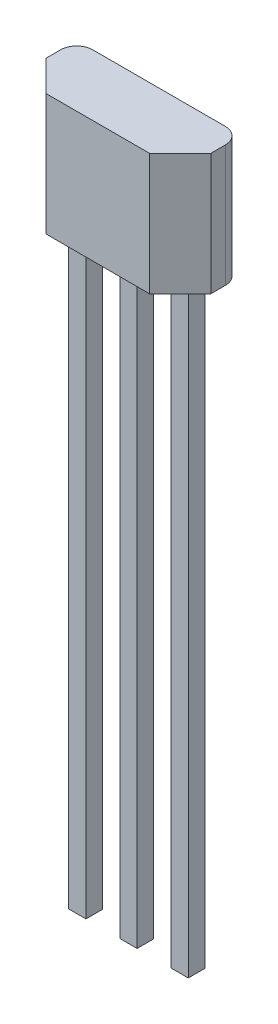
from build123d import *

# Parameters (mm, degrees)
BOSS_EXTRUDE1_DEPTH = 3.02
SKETCH3_W           = 0.43
SKETCH3_H           = 14.99
BOSS_EXTRUDE2_DEPTH = 0.41


with BuildPart() as part:
    # Sketch2 → Boss-Extrude1 (new body)
    with BuildSketch(Plane(origin=(0, 0, 0), x_dir=(1, 0, 0), z_dir=(0, 1, 0))):
        with BuildLine():
            Line((-1.645, 0.76), (1.645, 0.76))
            ThreePointArc((1.645, 0.76), (1.927842712, 0.642842712), (2.045, 0.36))
            Line((2.045, 0.36), (2.045, 0))
            Line((2.045, 0), (1.285, -0.76))
            Line((1.285, -0.76), (-1.285, -0.76))
            Line((-1.285, -0.76), (-2.045, 0))
            Line((-2.045, 0), (-2.045, 0.36))
            ThreePointArc((-2.045, 0.36), (-1.927842712, 0.642842712), (-1.645, 0.76))
        make_face()
    extrude(amount=BOSS_EXTRUDE1_DEPTH)

    # Sketch3 → Boss-Extrude2 (add)
    with BuildSketch(Plane.XY):
        with Locations((0, -7.495)):
            Rectangle(SKETCH3_W, SKETCH3_H)
        with Locations((1.27, -7.495)):
            Rectangle(SKETCH3_W, SKETCH3_H)
        with Locations((-1.27, -7.495)):
            Rectangle(SKETCH3_W, SKETCH3_H)
    extrude(amount=-BOSS_EXTRUDE2_DEPTH)


solid = part.part
